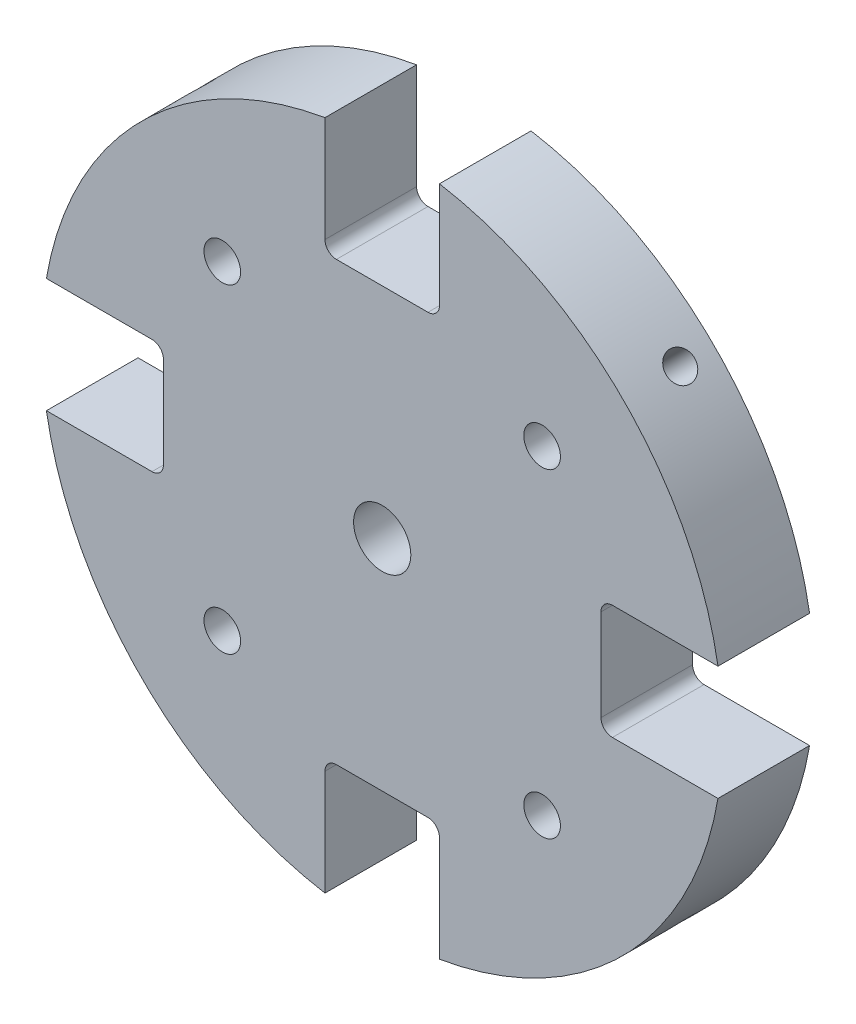
from build123d import *

# Parameters (mm, degrees)
SKETCH1_R             = 1.6
BOSS_EXTRUDE1_DEPTH   = 8
M6X1_0_TAPPED_HOLE1_D = 5
CIRPATTERN4_COUNT     = 4


with BuildPart() as part:
    # Sketch1 → Boss-Extrude1 (new body)
    with BuildSketch(Plane.XY):
        with BuildLine():
            Line((-29.326822194, 5), (-20.106608804, 5))
            ThreePointArc((-20.106608804, 5), (-19.399502023, 4.707106781), (-19.106608804, 4))
            Line((-19.106608804, 4), (-19.106608804, -4))
            ThreePointArc((-19.106608804, -4), (-19.399502023, -4.707106781), (-20.106608804, -5))
            Line((-20.106608804, -5), (-29.326822194, -5))
            ThreePointArc((-29.326822194, -5), (-21.03642674, -21.03642674), (-5, -29.326822194))
            Line((-5, -29.326822194), (-5, -20.106608804))
            ThreePointArc((-5, -20.106608804), (-4.707106781, -19.399502023), (-4, -19.106608804))
            Line((-4, -19.106608804), (4, -19.106608804))
            ThreePointArc((4, -19.106608804), (4.707106781, -19.399502023), (5, -20.106608804))
            Line((5, -20.106608804), (5, -29.326822194))
            ThreePointArc((5, -29.326822194), (21.03642674, -21.03642674), (29.326822194, -5))
            Line((29.326822194, -5), (20.106608804, -5))
            ThreePointArc((20.106608804, -5), (19.399502023, -4.707106781), (19.106608804, -4))
            Line((19.106608804, -4), (19.106608804, 4))
            ThreePointArc((19.106608804, 4), (19.399502023, 4.707106781), (20.106608804, 5))
            Line((20.106608804, 5), (29.326822194, 5))
            ThreePointArc((29.326822194, 5), (21.03642674, 21.03642674), (5, 29.326822194))
            Line((5, 29.326822194), (5, 20.106608804))
            ThreePointArc((5, 20.106608804), (4.707106781, 19.399502023), (4, 19.106608804))
            Line((4, 19.106608804), (-4, 19.106608804))
            ThreePointArc((-4, 19.106608804), (-4.707106781, 19.399502023), (-5, 20.106608804))
            Line((-5, 20.106608804), (-5, 29.326822194))
            ThreePointArc((-5, 29.326822194), (-21.03642674, 21.03642674), (-29.326822194, 5))
        make_face()
        with Locations((13.965358928, 13.965358928)):
            Circle(SKETCH1_R, mode=Mode.SUBTRACT)
        with Locations((13.965358928, -13.965358928)):
            Circle(SKETCH1_R, mode=Mode.SUBTRACT)
        with Locations((-13.965358928, -13.965358928)):
            Circle(SKETCH1_R, mode=Mode.SUBTRACT)
        with Locations((-13.965358928, 13.965358928)):
            Circle(SKETCH1_R, mode=Mode.SUBTRACT)
    extrude(amount=BOSS_EXTRUDE1_DEPTH)

    # M6x1.0 Tapped Hole1 (through all)
    with Locations(Plane.XY.offset(8)):
        with Locations((0, 0)):
            Hole(M6X1_0_TAPPED_HOLE1_D / 2)

    # Sketch10 → M3x0.5 Tapped Hole2 (revolve, cut)
    with BuildSketch(Plane(origin=(-21.03642674, -21.03642674, 3), x_dir=(0.707106781186559, -0.707106781186536, 0), z_dir=(0, 0, 1))):
        Polygon((0, 0), (0, 7), (1.25, 6.248924226), (1.25, 0), align=None)
    m3x0_5_tapped_hole2 = revolve(axis=Axis((-25.526554801, -25.526554801, 3), (0.707106781186536, 0.707106781186559, 0)), mode=Mode.SUBTRACT)

    # CirPattern4: M3x0.5 Tapped Hole2 ×4 about axis
    cirpattern4_axis = Axis((0, 0, 8), (0, 0, -1))
    for i in range(1, CIRPATTERN4_COUNT):
        add(m3x0_5_tapped_hole2.rotate(cirpattern4_axis, i * 360 / CIRPATTERN4_COUNT), mode=Mode.SUBTRACT)


solid = part.part
